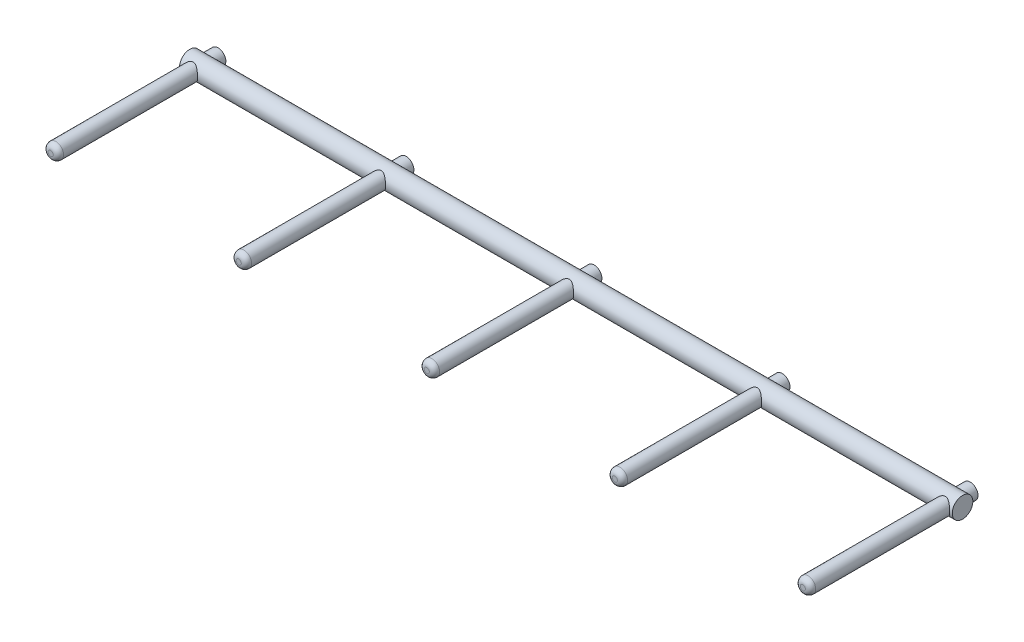
from build123d import *

# Parameters (mm, degrees)
ESQUISSE1_R                  = 4
BOSS_EXTRU_1_DEPTH           = 150
BOSS_EXTRU_3_START           = -7
ESQUISSE3_R                  = 3
BOSS_EXTRU_3_DEPTH           = 65
CONG_1_R                     = 2
R_P_TITION_LIN_AIRE1_COUNT   = 3
R_P_TITION_LIN_AIRE1_PITCH   = 73
R_P_TITION_LIN_AIRE1_2_COUNT = 3
R_P_TITION_LIN_AIRE1_2_PITCH = 73


with BuildPart() as part:
    # Esquisse1 → Boss.-Extru.1 (new, symmetric)
    with BuildSketch(Plane(origin=(0, 0, 0), x_dir=(0, 0, -1), z_dir=(1, 0, 0))):
        Circle(ESQUISSE1_R)
    extrude(amount=BOSS_EXTRU_1_DEPTH, both=True)


with BuildPart() as body_2:
    # Esquisse3 → Boss.-Extru.3 (new body)
    with BuildSketch(Plane.XY.offset(BOSS_EXTRU_3_START)):
        Circle(ESQUISSE3_R)
    extrude(amount=BOSS_EXTRU_3_DEPTH)

    # Congé1
    cong_1_edges = [body_2.edges().sort_by_distance(p)[0] for p in [
        (-3, 0, 58),
    ]]
    fillet(cong_1_edges, radius=CONG_1_R)


with BuildPart() as r_p_tition_lin_aire1_1:
    # Répétition linéaire1: pattern copy
    add(body_2.part.moved(Location(Vector(1, 0, 0) * (1 * R_P_TITION_LIN_AIRE1_PITCH))))


with BuildPart() as r_p_tition_lin_aire1_2:
    # Répétition linéaire1: pattern copy
    add(body_2.part.moved(Location(Vector(1, 0, 0) * (2 * R_P_TITION_LIN_AIRE1_PITCH))))


with BuildPart() as r_p_tition_lin_aire1_2_1:
    # R_p_tition lin_aire1 2: pattern copy
    add(body_2.part.moved(Location(Vector(-1, 0, 0) * (1 * R_P_TITION_LIN_AIRE1_2_PITCH))))


with BuildPart() as r_p_tition_lin_aire1_2_2:
    # R_p_tition lin_aire1 2: pattern copy
    add(body_2.part.moved(Location(Vector(-1, 0, 0) * (2 * R_P_TITION_LIN_AIRE1_2_PITCH))))


solid = Compound([part.part, body_2.part, r_p_tition_lin_aire1_1.part, r_p_tition_lin_aire1_2.part, r_p_tition_lin_aire1_2_1.part, r_p_tition_lin_aire1_2_2.part])
